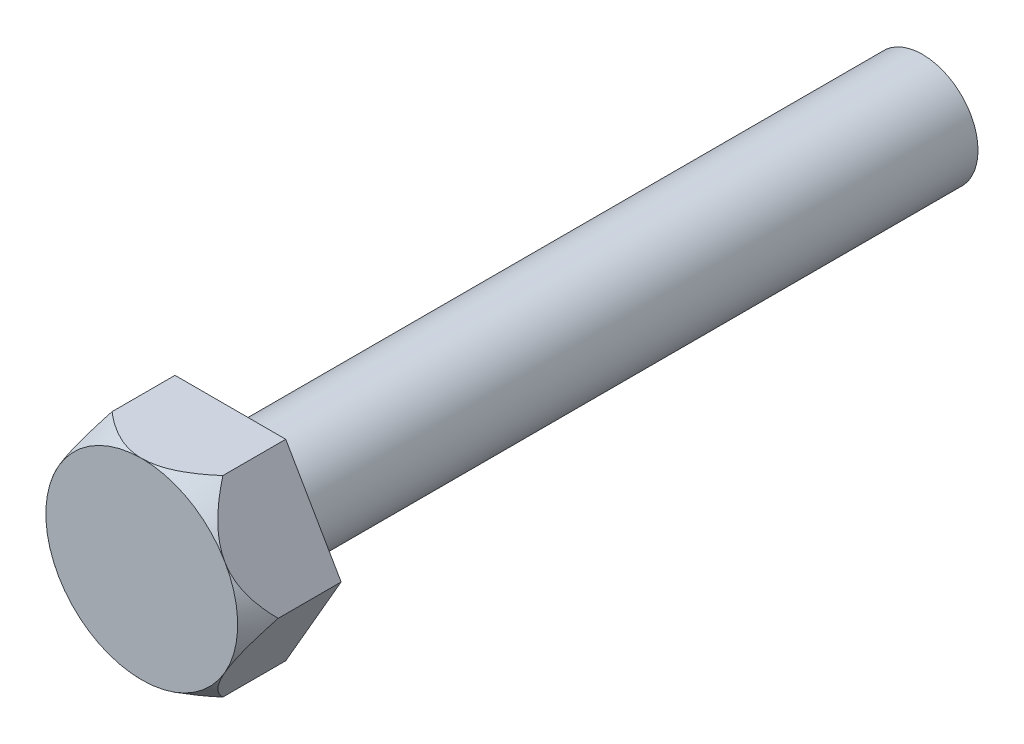
from build123d import *

# Parameters (mm, degrees)
BOSS_EXTRUDE1_DEPTH = 6.4
SKETCH2_OUTSIDE_W   = 29.812
SKETCH2_OUTSIDE_H   = 27.668
SKETCH2_OUTSIDE_R   = 6.92820323
CUT_EXTRUDE1_DEPTH  = 6.4
CUT_EXTRUDE1_DRAFT  = -30
SKETCH3_R           = 4
BOSS_EXTRUDE2_DEPTH = 50


with BuildPart() as part:
    # Sketch1 → Boss-Extrude1 (new body)
    with BuildSketch(Plane.XY):
        Polygon((8, 0), (4, 6.92820323), (-4, 6.92820323), (-8, 0), (-4, -6.92820323), (4, -6.92820323), align=None)
    extrude(amount=BOSS_EXTRUDE1_DEPTH)


with BuildPart() as cut_extrude1_tool:
    # Sketch2 outside → Cut-Extrude1 (with draft: the straight prism first)
    with BuildSketch(Plane.XY.offset(6.4)):
        Rectangle(SKETCH2_OUTSIDE_W, SKETCH2_OUTSIDE_H)
        Circle(SKETCH2_OUTSIDE_R, mode=Mode.SUBTRACT)
    extrude(amount=-CUT_EXTRUDE1_DEPTH)
    # Cut-Extrude1: the draft: its side faces are tilted about the plane it starts from
    cut_extrude1_sides = [cut_extrude1_tool.faces().sort_by_distance(p)[0] for p in [
        (0, -13.834, 3.2),
        (14.906, 0, 3.2),
        (0, 13.834, 3.2),
        (-14.906, 0, 3.2),
        (-6.92820323, 0, 3.2),
    ]]
    draft(cut_extrude1_sides, Plane.XY.offset(6.4), CUT_EXTRUDE1_DRAFT)


with BuildPart() as part_1:
    add(part.part)

    # Cut-Extrude1: cut by cut_extrude1_tool
    add(cut_extrude1_tool.part, mode=Mode.SUBTRACT)

    # Sketch3 → Boss-Extrude2 (add)
    with BuildSketch(Plane(origin=(0, 0, 0), x_dir=(-1, 0, 0), z_dir=(0, 0, -1))):
        with Locations(Location((0, 0, 0), (0, 0, 180))):
            Circle(SKETCH3_R)
    extrude(amount=BOSS_EXTRUDE2_DEPTH)


solid = part_1.part
